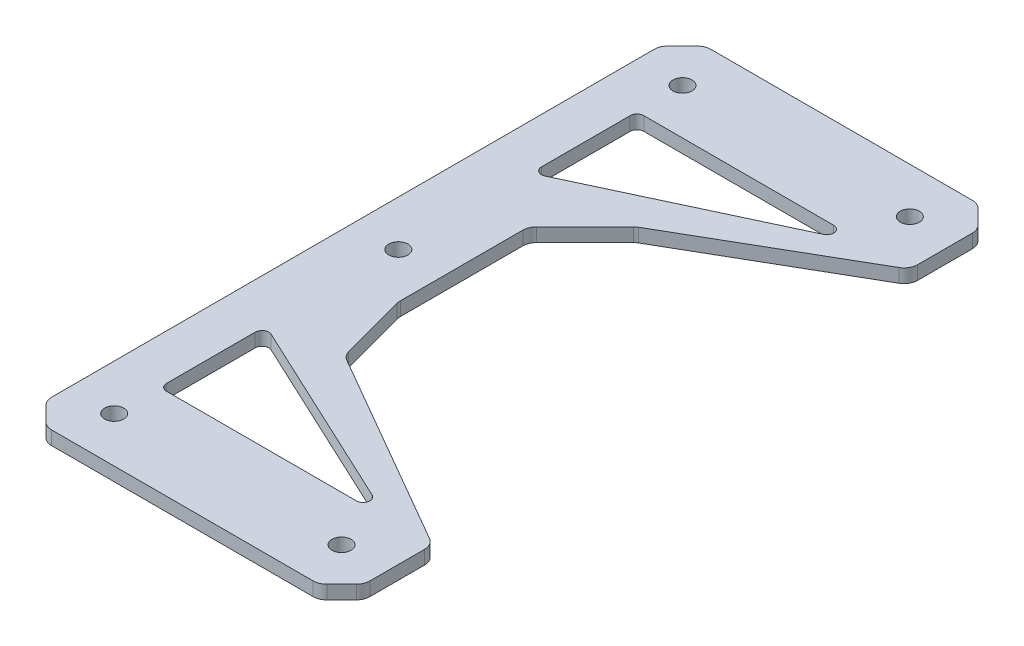
from build123d import *
from OCP.BRepFilletAPI import BRepFilletAPI_MakeChamfer

# Parameters (mm, degrees)
SKETCH_1_R          = 2.1
EXTRUDE_1_DEPTH     = 3
CHAMFER_1_SIZE      = 5
CHAMFER_1_SIZE2     = 13.660254038
FILLET_1_R          = 3
CUT_EXTRUDE_1_DEPTH = 10
FILLET_2_R          = 1.5


with BuildPart() as part:
    # 草图1 → 凸台-拉伸1 (new body)
    # profile 1 of 3: a face of its own
    with BuildSketch(Plane(origin=(0, 0, 0), x_dir=(1, 0, 0), z_dir=(0, 1, 0))):
        Polygon((10, 52.5), (10, 23.632486541), (60, 52.5), align=None)
    # profile 2 of 3: a face of its own
    with BuildSketch(Plane(origin=(0, 0, 0), x_dir=(1, 0, 0), z_dir=(0, 1, 0))):
        Polygon((10, -23.632486541), (10, -52.5), (60, -52.5), align=None)
    # profile 3 of 3: a face of its own
    with BuildSketch(Plane(origin=(0, 0, 0), x_dir=(1, 0, 0), z_dir=(0, 1, 0))):
        Polygon((60, -52.5), (60, -72.5), (-10, -72.5), (-10, 72.5), (60, 72.5), (60, 52.5), (10, 52.5), (10, -52.5), align=None)
        with Locations(Location((50, -62.5, 0), (0, 0, 270))):
            Circle(SKETCH_1_R, mode=Mode.SUBTRACT)
        with Locations(Location((0, 0, 0), (0, 0, 270))):
            Circle(SKETCH_1_R, mode=Mode.SUBTRACT)
        with Locations(Location((50, 62.5, 0), (0, 0, 270))):
            Circle(SKETCH_1_R, mode=Mode.SUBTRACT)
        with Locations(Location((0, 62.5, 0), (0, 0, 270))):
            Circle(SKETCH_1_R, mode=Mode.SUBTRACT)
        with Locations(Location((0, -62.5, 0), (0, 0, 270))):
            Circle(SKETCH_1_R, mode=Mode.SUBTRACT)
    extrude(amount=EXTRUDE_1_DEPTH)

    # 倒角1: one chamfer whose edges measure the first distance from different faces: ONE call of the kernel's chamfer builder (chamfer() names one face for all edges)
    chamfer_1_edges_1 = [part.edges().sort_by_distance(p)[0] for p in [
        (60, 1.5, 72.5),
        (-10, 1.5, 72.5),
        (-10, 1.5, -72.5),
        (60, 1.5, -72.5),
    ]]
    chamfer_1_edges_2 = [part.edges().sort_by_distance(p)[0] for p in [
        (10, 1.5, -23.632486541),
    ]]
    chamfer_1_side_2 = [part.faces().sort_by_distance(p)[0] for p in [
        (10, 1.5, 0),
    ]]
    chamfer_1_edges_3 = [part.edges().sort_by_distance(p)[0] for p in [
        (10, 1.5, 23.632486541),
    ]]
    chamfer_1_side_3 = [part.faces().sort_by_distance(p)[0] for p in [
        (35, 1.5, 38.06624327),
    ]]
    chamfer_1 = BRepFilletAPI_MakeChamfer(part.part.solid().wrapped)
    for e in chamfer_1_edges_1:
        chamfer_1.Add(CHAMFER_1_SIZE, e.wrapped)
    for e in chamfer_1_edges_2:
        chamfer_1.Add(CHAMFER_1_SIZE, CHAMFER_1_SIZE2, e.wrapped, chamfer_1_side_2[0].wrapped)  # the first distance lies on this face
    for e in chamfer_1_edges_3:
        chamfer_1.Add(CHAMFER_1_SIZE, CHAMFER_1_SIZE2, e.wrapped, chamfer_1_side_3[0].wrapped)  # the first distance lies on this face
    add(Compound.cast(chamfer_1.Shape()), mode=Mode.REPLACE)

    # 圆角1
    fillet_1_edges = [part.edges().sort_by_distance(p)[0] for p in [
        (60, 1.5, -52.5),
        (60, 1.5, 52.5),
        (60, 1.5, 67.5),
        (-5, 1.5, 72.5),
        (55, 1.5, 72.5),
        (-10, 1.5, -67.5),
        (-10, 1.5, 67.5),
        (10, 1.5, -18.632486541),
        (10, 1.5, 9.972232503),
        (14.330127019, 1.5, 26.132486541),
        (21.830127019, 1.5, -30.462613559),
        (-5, 1.5, -72.5),
        (55, 1.5, -72.5),
        (60, 1.5, -67.5),
    ]]
    fillet(fillet_1_edges, radius=FILLET_1_R)

    # 草图3 → 切除-拉伸1 (cut)
    with BuildSketch(Plane(origin=(0, 3, 0), x_dir=(1, 0, 0), z_dir=(0, 1, 0))):
        Polygon((0, -52.5), (0, -29.126059631), (50, -52.5), align=None)
        Polygon((0, 52.5), (0, 29.126059631), (50, 52.5), align=None)
    extrude(amount=-CUT_EXTRUDE_1_DEPTH, mode=Mode.SUBTRACT)

    # 圆角2
    fillet_2_edges = [part.edges().sort_by_distance(p)[0] for p in [
        (0, 1.5, 52.5),
        (0, 1.5, 29.126059631),
        (50, 1.5, 52.5),
        (0, 1.5, -52.5),
        (50, 1.5, -52.5),
        (0, 1.5, -29.126059631),
    ]]
    fillet(fillet_2_edges, radius=FILLET_2_R)


solid = part.part
